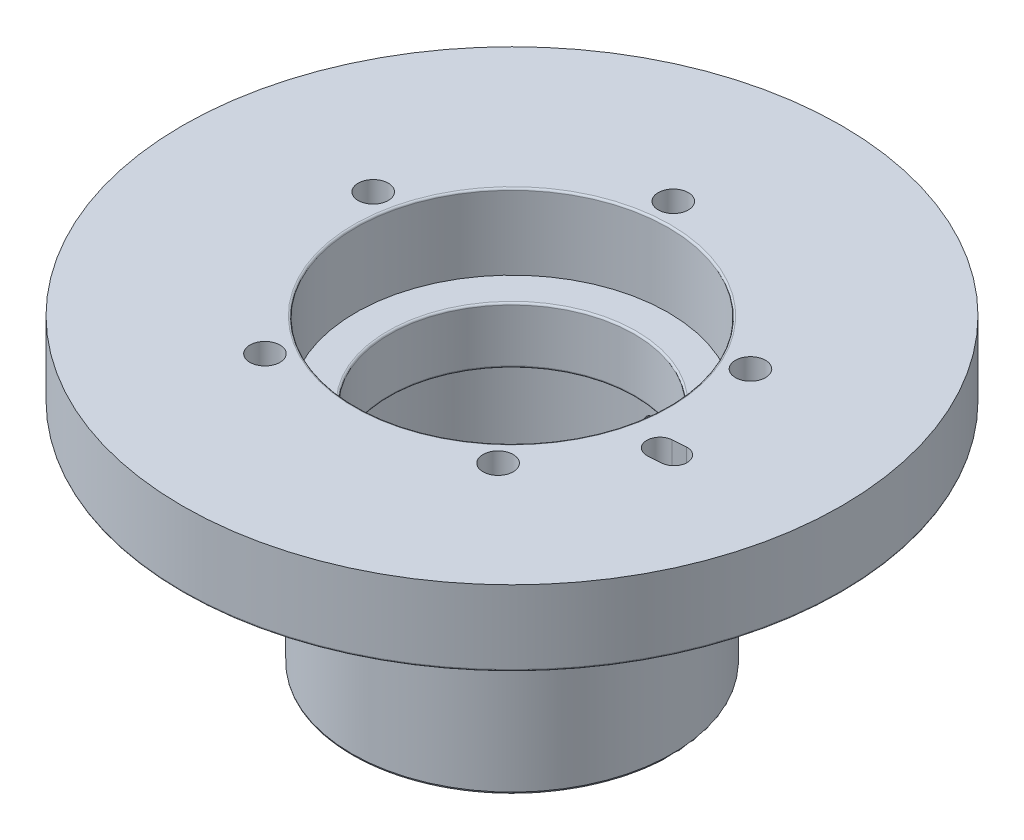
from build123d import *

# Parameters (mm, degrees)
CUT_EXTRUDE6_DEPTH      = 148.351620397
CUT_EXTRUDE6_DEPTH_BACK = 148.351620397
SKETCH6_R               = 2.5
SKETCH8_R               = 4
CUT_EXTRUDE8_DEPTH      = 15
CUT_EXTRUDE9_DEPTH      = 148.351620397


with BuildPart() as part:
    # Sketch1 → Revolve1 (revolve)
    with BuildSketch(Plane.XY):
        with BuildLine():
            Line((-87.5, -19.5), (-87.5, 0))
            Line((-87.5, 0), (-42, 0))
            ThreePointArc((-42, 0), (-41.646446609, -0.146446609), (-41.5, -0.5))
            Line((-41.5, -0.5), (-41.5, -20))
            Line((-41.5, -20), (-33, -20))
            ThreePointArc((-33, -20), (-32.646446609, -20.146446609), (-32.5, -20.5))
            Line((-32.5, -20.5), (-32.5, -34.5))
            ThreePointArc((-32.5, -34.5), (-32.646446609, -34.853553391), (-33, -35))
            Line((-33, -35), (-37, -35))
            ThreePointArc((-37, -35), (-37.353553391, -35.146446609), (-37.5, -35.5))
            Line((-37.5, -35.5), (-37.5, -79.5))
            ThreePointArc((-37.5, -79.5), (-37.646446609, -79.853553391), (-38, -80))
            Line((-38, -80), (-42, -80))
            ThreePointArc((-42, -80), (-42.353553391, -79.853553391), (-42.5, -79.5))
            Line((-42.5, -79.5), (-42.5, -25.5))
            ThreePointArc((-42.5, -25.5), (-42.646446609, -25.146446609), (-43, -25))
            Line((-43, -25), (-47, -25))
            ThreePointArc((-47, -25), (-47.353553391, -24.853553391), (-47.5, -24.5))
            Line((-47.5, -24.5), (-47.5, -20.5))
            ThreePointArc((-47.5, -20.5), (-47.646446609, -20.146446609), (-48, -20))
            Line((-48, -20), (-87, -20))
            ThreePointArc((-87, -20), (-87.353553391, -19.853553391), (-87.5, -19.5))
        make_face()
    revolve(axis=Axis((0, -100.5, 0), (0, 1, 0)))

    # Sketch6 → Cut-Extrude6 (cut, two sides: drawn at the far end of the back side and taken through both)
    with BuildSketch(Plane.XY.offset(-CUT_EXTRUDE6_DEPTH_BACK)):
        with Locations((0, -44.5)):
            Circle(SKETCH6_R)
    extrude(amount=CUT_EXTRUDE6_DEPTH + CUT_EXTRUDE6_DEPTH_BACK, mode=Mode.SUBTRACT)

    # Sketch8 → Cut-Extrude8 (cut)
    with BuildSketch(Plane(origin=(0, 0, 0), x_dir=(1, 0, 0), z_dir=(0, 1, 0))):
        with Locations((43.889838941, 19.434043267)):
            Circle(SKETCH8_R)
        with Locations((-4.920167374, 47.747166963)):
            Circle(SKETCH8_R)
        with Locations((-46.930669609, 10.075328782)):
            Circle(SKETCH8_R)
        with Locations((-24.084581559, -41.520271328)):
            Circle(SKETCH8_R)
        with Locations((32.045579601, -35.736267685)):
            Circle(SKETCH8_R)
    extrude(amount=-CUT_EXTRUDE8_DEPTH, mode=Mode.SUBTRACT)

    # Sketch9 → Cut-Extrude9 (cut, through all)
    with BuildSketch(Plane(origin=(0, 0, 0), x_dir=(1, 0, 0), z_dir=(0, 1, 0))):
        with BuildLine():
            Line((53.768061866, -13.987725184), (50.276679454, -14.233181596))
            ThreePointArc((50.276679454, -14.233181596), (46.539840629, -10.987255596), (49.785766629, -7.250416771))
            Line((49.785766629, -7.250416771), (53.277149042, -7.004960359))
            ThreePointArc((53.277149042, -7.004960359), (57.013987866, -10.250886359), (53.768061866, -13.987725184))
        make_face()
    extrude(amount=-CUT_EXTRUDE9_DEPTH, mode=Mode.SUBTRACT)


solid = part.part
